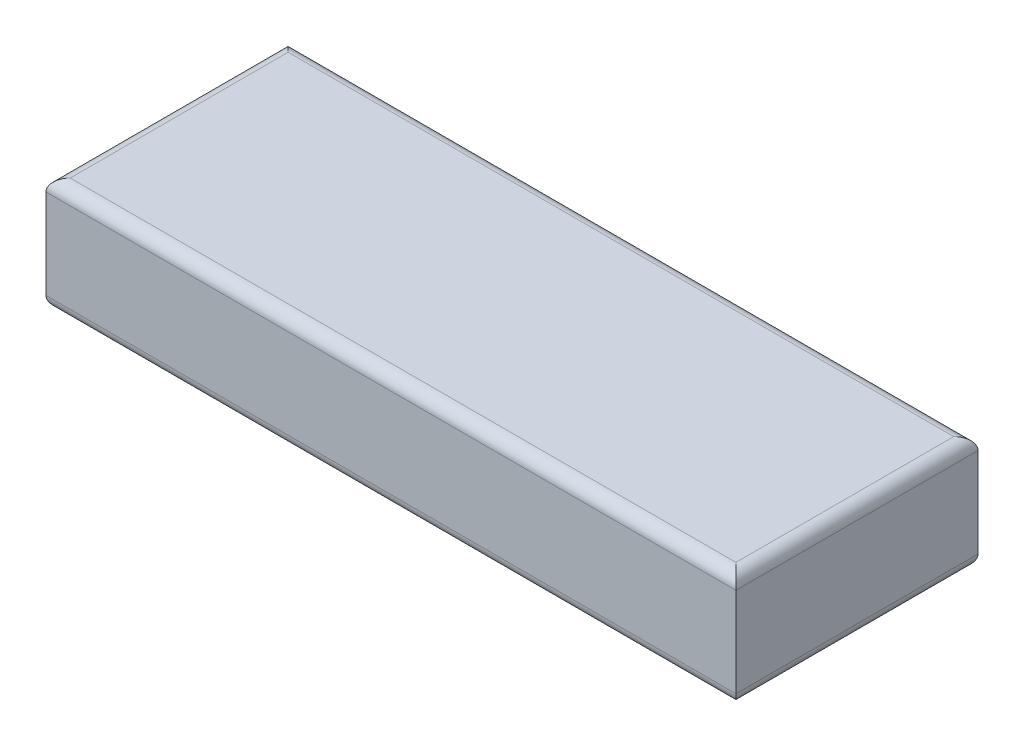
from build123d import *

# Parameters (mm, degrees)
SKETCH1_W           = 28.956
SKETCH1_H           = 10.16
BOSS_EXTRUDE1_DEPTH = 4.775287897
FILLET1_R           = 0.508


with BuildPart() as part:
    # Sketch1 → Boss-Extrude1 (new body)
    with BuildSketch(Plane(origin=(0, 0, 0), x_dir=(1, 0, 0), z_dir=(0, 1, 0))):
        Rectangle(SKETCH1_W, SKETCH1_H)
    extrude(amount=BOSS_EXTRUDE1_DEPTH)

    # Fillet1
    fillet1_edges = [part.edges().sort_by_distance(p)[0] for p in [
        (-14.478, 4.775287897, 0),
        (0, 4.775287897, 5.08),
        (14.478, 4.775287897, 0),
        (0, 0, 5.08),
        (-14.478, 0, 0),
        (0, 0, -5.08),
        (14.478, 0, 0),
        (0, 4.775287897, -5.08),
    ]]
    fillet(fillet1_edges, radius=FILLET1_R)


solid = part.part
